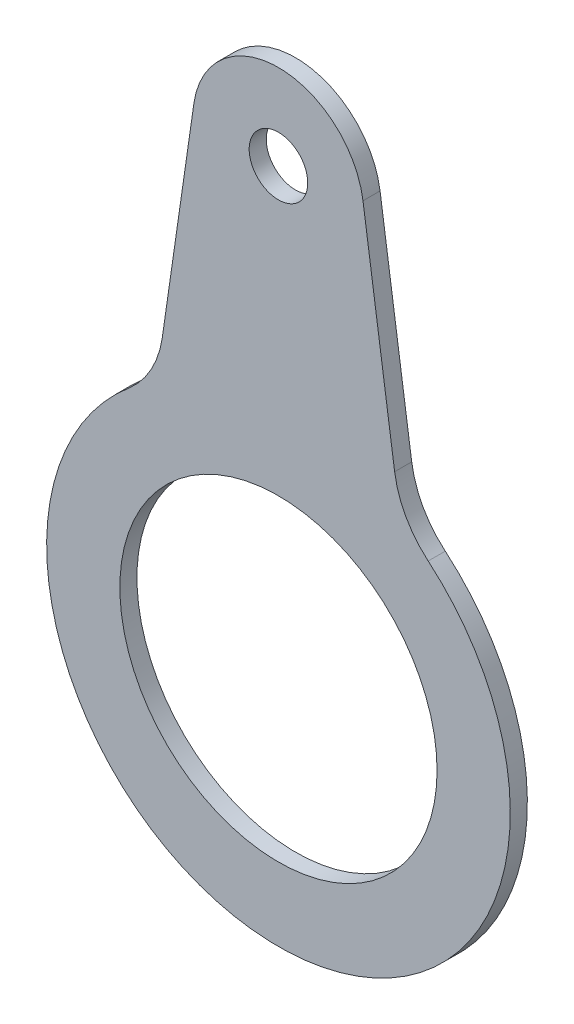
from build123d import *

# Parameters (mm, degrees)
SKETCH_1_R      = 3.25
SKETCH_1_R_2    = 0.6
EXTRUDE_1_DEPTH = 0.35


with BuildPart() as part:
    # Эскиз1 → Вытянуть1 (new body)
    with BuildSketch(Plane.XY):
        with BuildLine():
            Line((2.380261504, 4.86702901), (1.731990268, 9.350710913))
            ThreePointArc((1.731990268, 9.350710913), (0, 10.850291839), (-1.731990268, 9.350710913))
            Line((-1.731990268, 9.350710913), (-2.380261504, 4.86702901))
            ThreePointArc((-2.380261504, 4.86702901), (-2.610401545, 4.183671542), (-3.067922226, 3.626341575))
            ThreePointArc((-3.067922226, 3.626341575), (0, -4.75), (3.067922226, 3.626341575))
            ThreePointArc((3.067922226, 3.626341575), (2.610401545, 4.183671542), (2.380261504, 4.86702901))
        make_face()
        Circle(SKETCH_1_R, mode=Mode.SUBTRACT)
        with Locations((0, 9.100291839)):
            Circle(SKETCH_1_R_2, mode=Mode.SUBTRACT)
    extrude(amount=EXTRUDE_1_DEPTH)


solid = part.part
